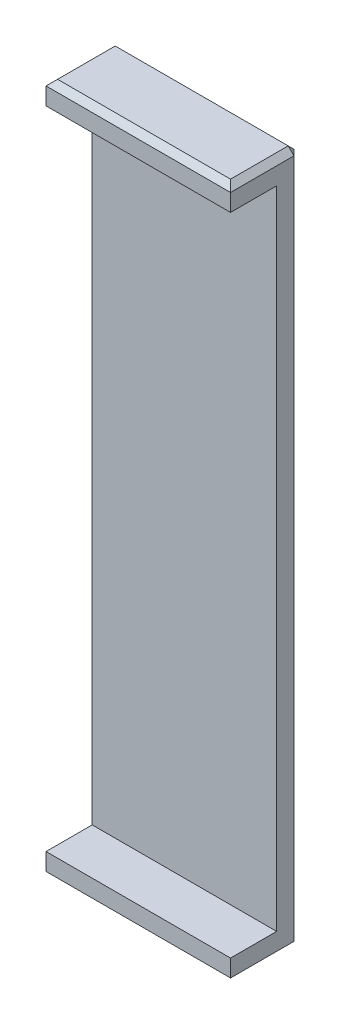
from build123d import *

# Parameters (mm, degrees)
SKETCH_1_W      = 80
SKETCH_1_H      = 300
EXTRUDE_1_DEPTH = 10
SKETCH_2_W      = 80
SKETCH_2_H      = 10
EXTRUDE_2_DEPTH = 20
CHAMFER_1_SIZE  = 2.5


with BuildPart() as part:
    # 草圖1 → 填料-伸長1 (new body)
    with BuildSketch(Plane.XY):
        with Locations((78.435797513, 9.285783834)):
            Rectangle(SKETCH_1_W, SKETCH_1_H)
    extrude(amount=-EXTRUDE_1_DEPTH)

    # 草圖2 → 填料-伸長2 (add)
    with BuildSketch(Plane.XY):
        with Locations((78.435797513, -135.714216166)):
            Rectangle(SKETCH_2_W, SKETCH_2_H)
        with Locations((78.435797513, 154.285783834)):
            Rectangle(SKETCH_2_W, SKETCH_2_H)
    extrude(amount=EXTRUDE_2_DEPTH)

    # 導角1
    chamfer_1_edges = [part.edges().sort_by_distance(p)[0] for p in [
        (118.435797513, 9.285783834, -10),
        (78.435797513, 159.285783834, -10),
        (78.435797513, -140.714216166, 20),
        (78.435797513, 159.285783834, 20),
        (38.435797513, 9.285783834, -10),
        (78.435797513, -140.714216166, -10),
        (38.435797513, 159.285783834, 5),
        (118.435797513, 159.285783834, 5),
        (118.435797513, -140.714216166, 5),
        (38.435797513, -140.714216166, 5),
    ]]
    chamfer(chamfer_1_edges, length=CHAMFER_1_SIZE)


solid = part.part
